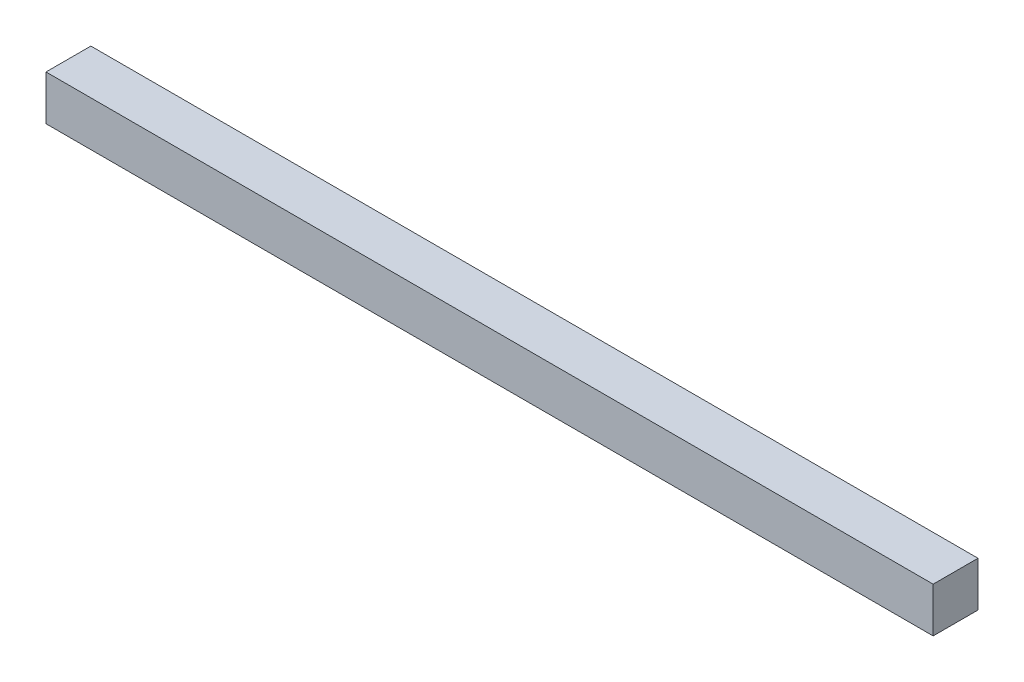
from build123d import *

# Parameters (mm, degrees)
BOSS_EXTRUDE1_DEPTH      = 89
BOSS_EXTRUDE1_DEPTH_BACK = 89
SKETCH2_W                = 9
SKETCH2_H                = 9


with BuildPart() as part:
    # Sketch2 → Boss-Extrude1 (new, two sides: drawn at the far end of the back side and taken through both)
    with BuildSketch(Plane(origin=(0, 0, 0), x_dir=(0, 0, -1), z_dir=(1, 0, 0)).offset(-BOSS_EXTRUDE1_DEPTH_BACK)):
        Rectangle(SKETCH2_W, SKETCH2_H)
    extrude(amount=BOSS_EXTRUDE1_DEPTH + BOSS_EXTRUDE1_DEPTH_BACK)


solid = part.part
